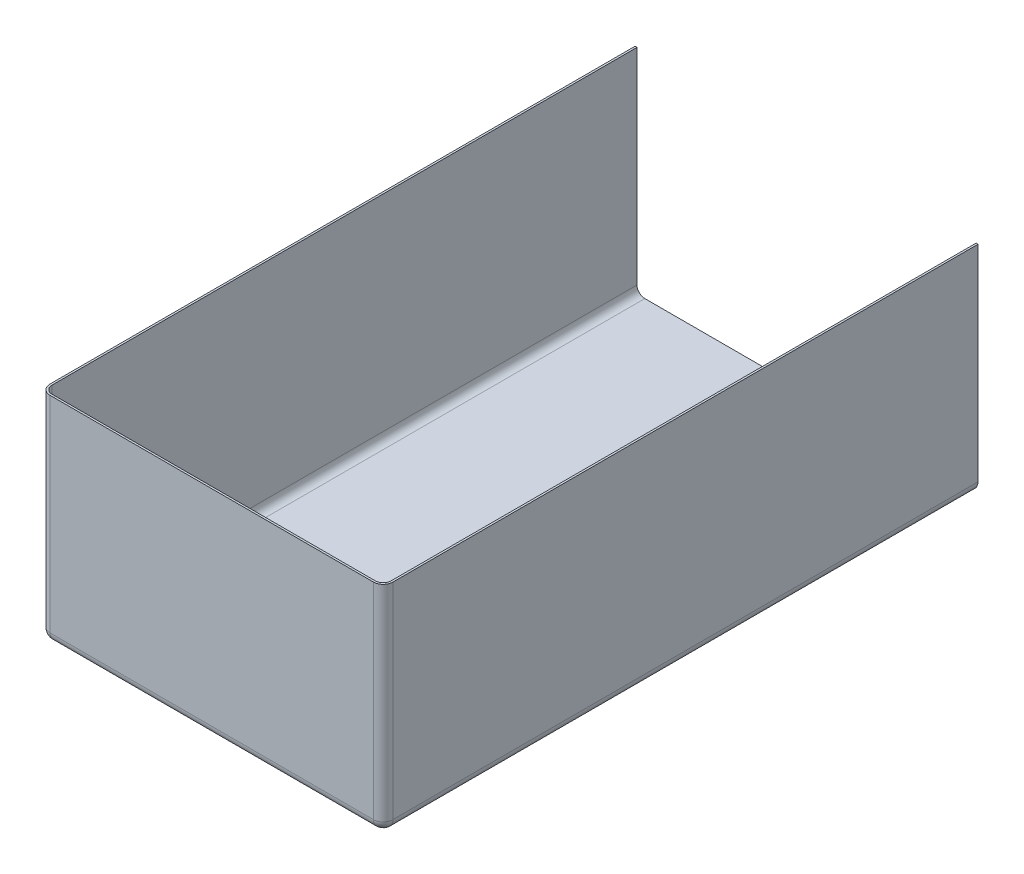
from build123d import *

# Parameters (mm, degrees)
SKETCH_1_W      = 350
SKETCH_1_H      = 220
EXTRUDE_1_DEPTH = 607
FILLET_1_R      = 10
SHELL_1_T       = -2


with BuildPart() as part:
    # 草图1 → 凸台-拉伸1 (new body)
    with BuildSketch(Plane.XY):
        Rectangle(SKETCH_1_W, SKETCH_1_H)
    extrude(amount=EXTRUDE_1_DEPTH)

    # 圆角1
    fillet_1_edges = [part.edges().sort_by_distance(p)[0] for p in [
        (-175, 0, 607),
        (0, -110, 607),
        (175, 0, 607),
        (175, -110, 303.5),
        (-175, -110, 303.5),
    ]]
    fillet(fillet_1_edges, radius=FILLET_1_R)

    # 抽壳1
    shell_1_openings = [part.faces().sort_by_distance(p)[0] for p in [
        (0, 0.060103243, 0),
        (0, 110, 303.439124152),
    ]]
    offset(amount=SHELL_1_T, openings=shell_1_openings, kind=Kind.INTERSECTION)


solid = part.part
